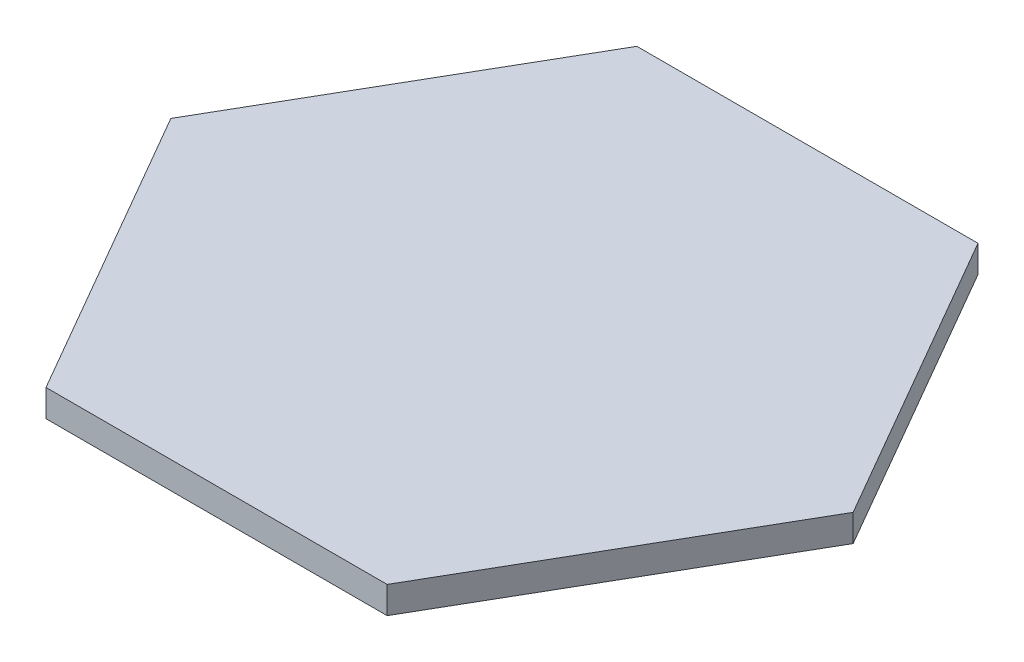
from build123d import *

# Parameters (mm, degrees)
BOSS_EXTRUDE1_DEPTH = 6.35


with BuildPart() as part:
    # Sketch2 → Boss-Extrude1 (new body)
    with BuildSketch(Plane(origin=(0, 0, 0), x_dir=(1, 0, 0), z_dir=(0, 1, 0))):
        Polygon((-80, 0), (-40, -69.282032303), (40, -69.282032303), (80, 0), (40, 69.282032303), (-40, 69.282032303), align=None)
    extrude(amount=BOSS_EXTRUDE1_DEPTH)


solid = part.part
